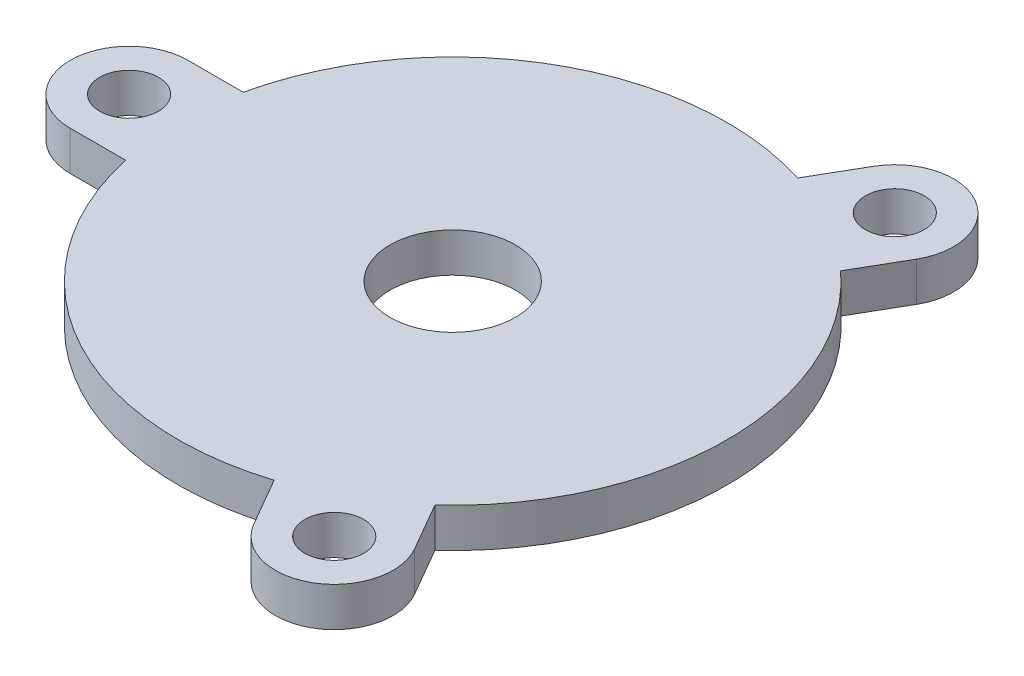
from build123d import *

# Parameters (mm, degrees)
SKETCH_1_R      = 1.5
SKETCH_1_R_2    = 3.2
EXTRUDE_1_DEPTH = 2


with BuildPart() as part:
    # 草图1 → 凸台-拉伸1 (new body)
    with BuildSketch(Plane(origin=(0, 0, 0), x_dir=(1, 0, 0), z_dir=(0, 1, 0))):
        with BuildLine():
            ThreePointArc((-16.5, 3), (-19.5, 0), (-16.5, -3))
            Line((-16.5, -3), (-13.674794331, -3))
            ThreePointArc((-13.674794331, -3), (-7, -12.124355653), (4.239320954, -13.342719282))
            Line((4.239320954, -13.342719282), (5.651923789, -15.789419162))
            ThreePointArc((5.651923789, -15.789419162), (9.75, -16.887495374), (10.848076211, -12.789419162))
            Line((10.848076211, -12.789419162), (9.435473377, -10.342719282))
            ThreePointArc((9.435473377, -10.342719282), (14, 0), (9.435473377, 10.342719282))
            Line((9.435473377, 10.342719282), (10.848076211, 12.789419162))
            ThreePointArc((10.848076211, 12.789419162), (9.75, 16.887495374), (5.651923789, 15.789419162))
            Line((5.651923789, 15.789419162), (4.239320954, 13.342719282))
            ThreePointArc((4.239320954, 13.342719282), (-7, 12.124355653), (-13.674794331, 3))
            Line((-13.674794331, 3), (-16.5, 3))
        make_face()
        with Locations(Location((-16.5, 0, 0), (0, 0, 270))):
            Circle(SKETCH_1_R, mode=Mode.SUBTRACT)
        with Locations(Location((8.25, -14.289419162, 0), (0, 0, 270))):
            Circle(SKETCH_1_R, mode=Mode.SUBTRACT)
        with Locations(Location((0, 0, 0), (0, 0, 270))):
            Circle(SKETCH_1_R_2, mode=Mode.SUBTRACT)
        with Locations(Location((8.25, 14.289419162, 0), (0, 0, 270))):
            Circle(SKETCH_1_R, mode=Mode.SUBTRACT)
    extrude(amount=EXTRUDE_1_DEPTH)


solid = part.part
